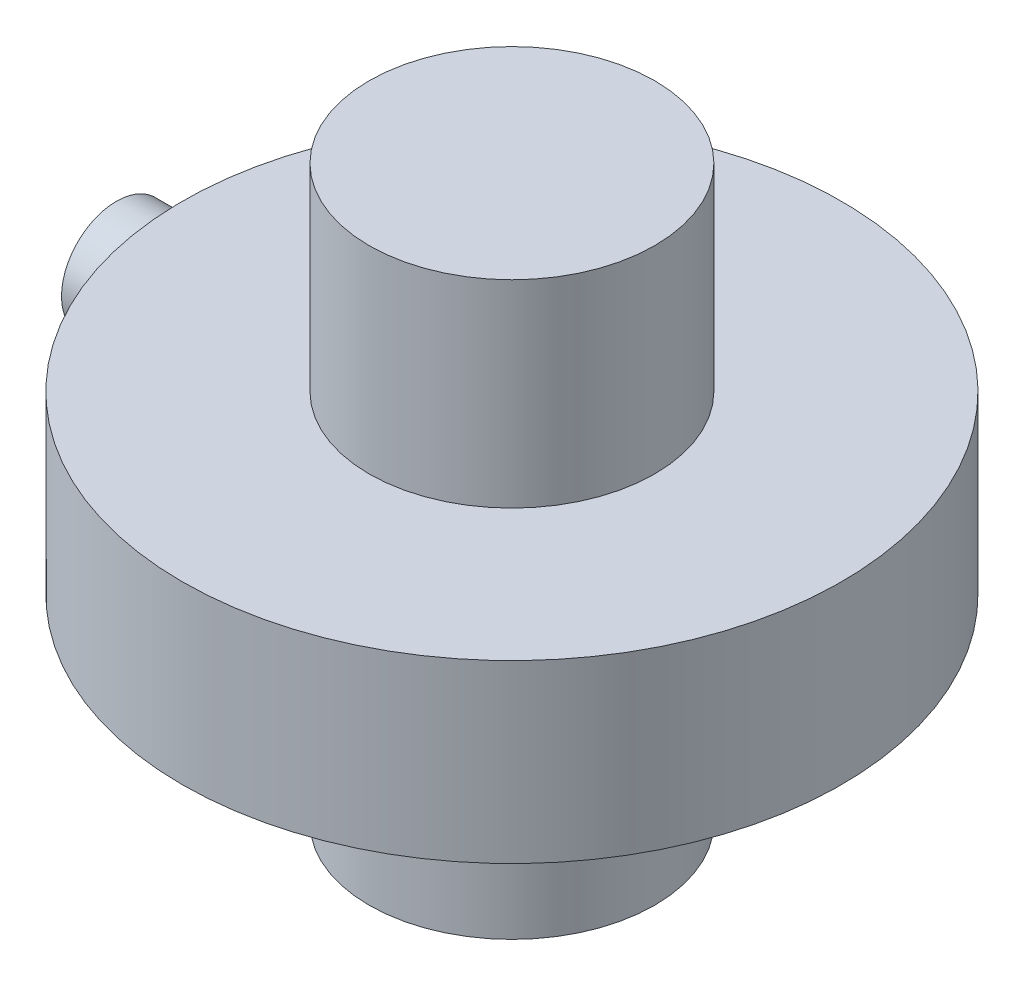
from build123d import *

# Parameters (mm, degrees)
SKETCH1_R           = 5
BOSS_EXTRUDE1_DEPTH = 10
SKETCH2_R           = 30
BOSS_EXTRUDE2_DEPTH = 8
SKETCH3_R           = 13
BOSS_EXTRUDE3_DEPTH = 26


with BuildPart() as part:
    # Sketch1 → Boss-Extrude1 (new body)
    with BuildSketch(Plane(origin=(0, 0, 0), x_dir=(0, 0, -1), z_dir=(1, 0, 0))):
        Circle(SKETCH1_R)
    extrude(amount=BOSS_EXTRUDE1_DEPTH)

    # Sketch2 → Boss-Extrude2 (add, symmetric)
    with BuildSketch(Plane(origin=(0, 0, 0), x_dir=(1, 0, 0), z_dir=(0, 1, 0))):
        with Locations(Location((36, 0, 0), (0, 0, 270))):
            Circle(SKETCH2_R)
    extrude(amount=BOSS_EXTRUDE2_DEPTH, both=True)

    # Sketch3 → Boss-Extrude3 (add, symmetric)
    with BuildSketch(Plane(origin=(0, 0, 0), x_dir=(1, 0, 0), z_dir=(0, 1, 0))):
        with Locations(Location((36, 0, 0), (0, 0, 90))):
            Circle(SKETCH3_R)
    extrude(amount=BOSS_EXTRUDE3_DEPTH, both=True)


solid = part.part
